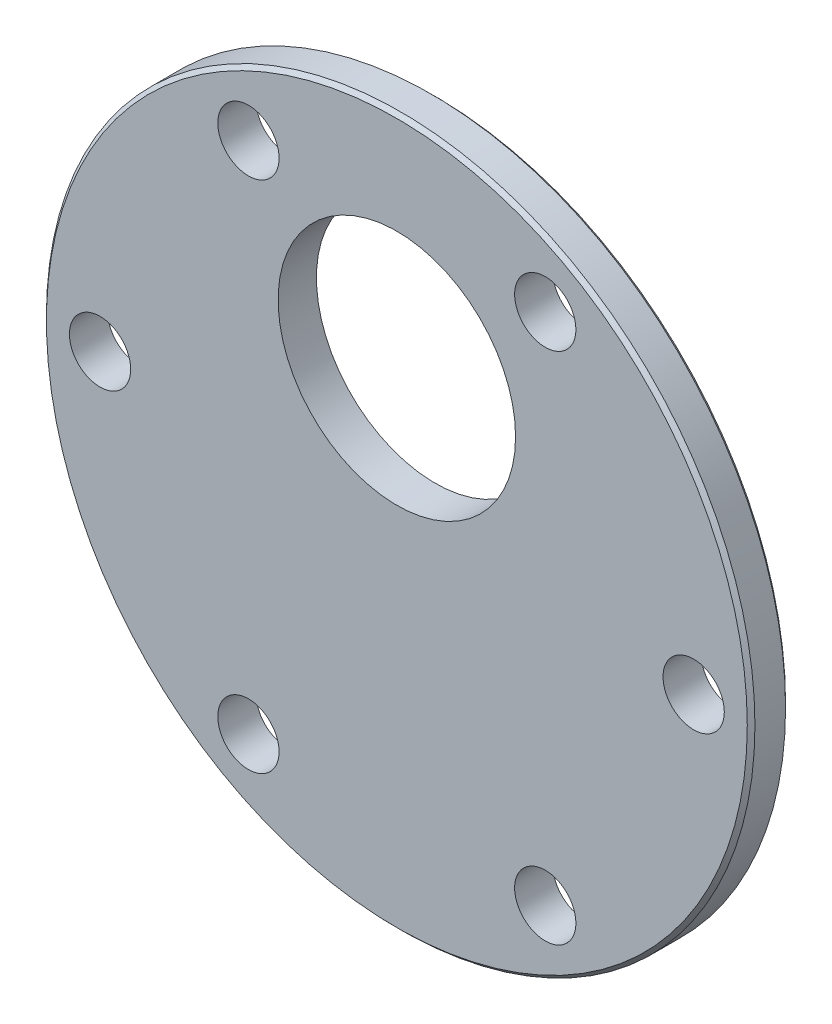
from build123d import *

# Parameters (mm, degrees)
SKETCH_1_R      = 18.5
SKETCH_1_R_2    = 6.2
SKETCH_1_R_3    = 1.6
EXTRUDE_1_DEPTH = 2
CHAMFER_1_SIZE  = 0.2


with BuildPart() as part:
    # 草图1 → 凸台-拉伸1 (new body)
    with BuildSketch(Plane.XY):
        with Locations((0, -7)):
            Circle(SKETCH_1_R)
        Circle(SKETCH_1_R_2, mode=Mode.SUBTRACT)
        with Locations((15.5, -7)):
            Circle(SKETCH_1_R_3, mode=Mode.SUBTRACT)
        with Locations((7.75, -20.423393759)):
            Circle(SKETCH_1_R_3, mode=Mode.SUBTRACT)
        with Locations((-7.75, -20.423393759)):
            Circle(SKETCH_1_R_3, mode=Mode.SUBTRACT)
        with Locations((-15.5, -7)):
            Circle(SKETCH_1_R_3, mode=Mode.SUBTRACT)
        with Locations((-7.75, 6.423393759)):
            Circle(SKETCH_1_R_3, mode=Mode.SUBTRACT)
        with Locations((7.75, 6.423393759)):
            Circle(SKETCH_1_R_3, mode=Mode.SUBTRACT)
    extrude(amount=EXTRUDE_1_DEPTH)

    # 倒角1
    chamfer_1_edges = [part.edges().sort_by_distance(p)[0] for p in [
        (-18.5, -7, 0),
        (-18.5, -7, 2),
    ]]
    chamfer(chamfer_1_edges, length=CHAMFER_1_SIZE)


solid = part.part
